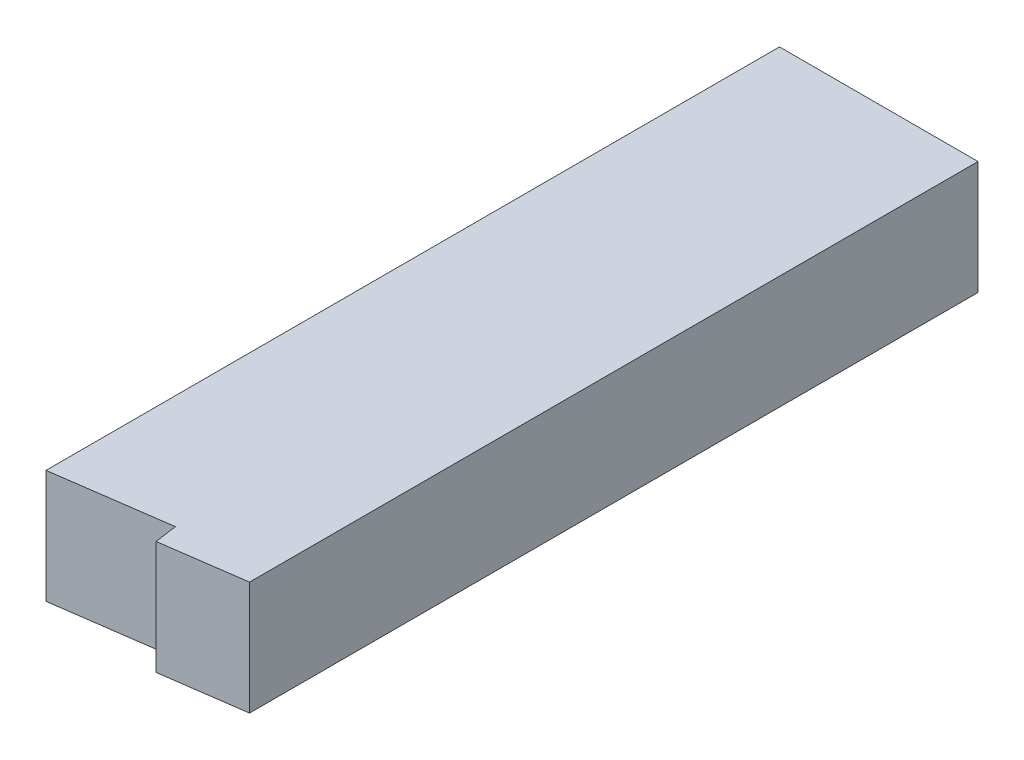
from build123d import *

# Parameters (mm, degrees)
SKETCH1_W               = 101.6
SKETCH1_H               = 50.8
BOSS_EXTRUDE1_DEPTH     = 331.365720046
CUT_EXTRUDE1_DEPTH      = 340.064183336
CUT_EXTRUDE1_DEPTH_BACK = 340.064183336
CUT_EXTRUDE2_DEPTH      = 340.064183336
CUT_EXTRUDE2_DEPTH_BACK = 340.064183336
SKETCH3_W               = 12.7
SKETCH3_H               = 355.6


with BuildPart() as part:
    # Sketch1 → Boss-Extrude1 (new body)
    with BuildSketch(Plane.XY):
        Rectangle(SKETCH1_W, SKETCH1_H)
    extrude(amount=BOSS_EXTRUDE1_DEPTH)

    # Sketch2 → Cut-Extrude1 (cut, two sides: drawn at the far end of the back side and taken through both)
    with BuildSketch(Plane(origin=(0, 25.4, 0), x_dir=(1, 0, 0), z_dir=(0, 1, 0)).offset(-CUT_EXTRUDE1_DEPTH_BACK)):
        Polygon((50.8, -324.424970201), (1.413998706, -331.365720046), (50.8, -331.365720046), align=None)
        Polygon((0, -321.304596468), (-50.8, -328.44407087), (-50.8, -331.365720046), (1.413998706, -331.365720046), align=None)
    extrude(amount=CUT_EXTRUDE1_DEPTH + CUT_EXTRUDE1_DEPTH_BACK, mode=Mode.SUBTRACT)

    # Sketch3 → Cut-Extrude2 (cut, two sides: drawn at the far end of the back side and taken through both)
    with BuildSketch(Plane.XZ.offset(25.4).offset(-CUT_EXTRUDE2_DEPTH_BACK)):
        with Locations((44.45, 177.8)):
            Rectangle(SKETCH3_W, SKETCH3_H)
    extrude(amount=CUT_EXTRUDE2_DEPTH + CUT_EXTRUDE2_DEPTH_BACK, mode=Mode.SUBTRACT)


solid = part.part
